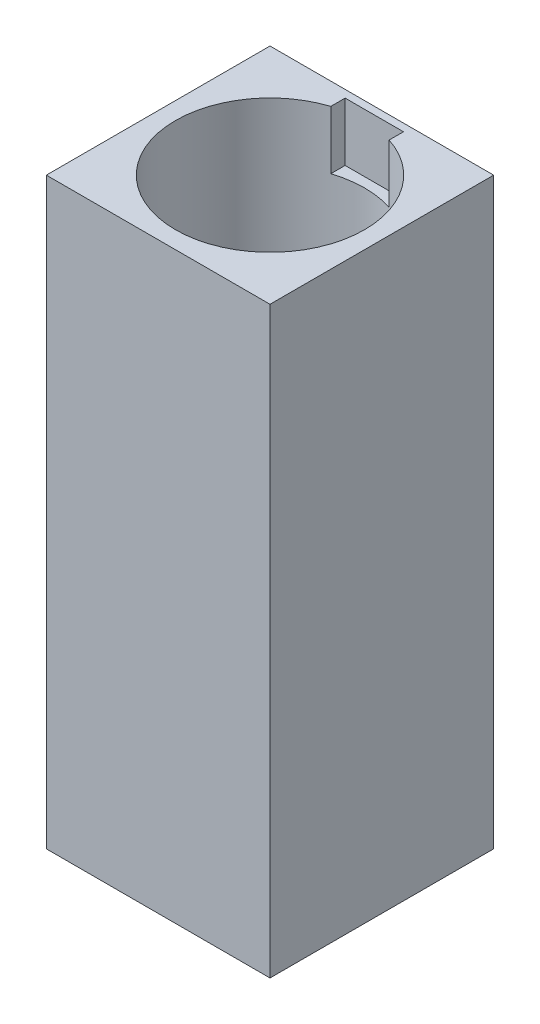
from build123d import *

# Parameters (mm, degrees)
SKETCH1_W           = 23
SKETCH1_H           = 23
BOSS_EXTRUDE1_DEPTH = 60
SKETCH2_R           = 9.725
CUT_EXTRUDE1_DEPTH  = 39
SKETCH3_R           = 6.75
CUT_EXTRUDE2_DEPTH  = 51.783855702
SKETCH5_W           = 6
SKETCH5_H           = 2.398717271
CUT_EXTRUDE3_DEPTH  = 6


with BuildPart() as part:
    # Sketch1 → Boss-Extrude1 (new body)
    with BuildSketch(Plane(origin=(0, 0, 0), x_dir=(-1, 0, 0), z_dir=(0, 1, 0))):
        with Locations((11.5, 11.5)):
            Rectangle(SKETCH1_W, SKETCH1_H)
    extrude(amount=BOSS_EXTRUDE1_DEPTH)

    # Sketch2 → Cut-Extrude1 (cut)
    with BuildSketch(Plane(origin=(0, 60, 0), x_dir=(-1, 0, 0), z_dir=(0, 1, 0))):
        with Locations(Location((11.5, 11.5, 0), (0, 0, 90))):
            Circle(SKETCH2_R)
    extrude(amount=-CUT_EXTRUDE1_DEPTH, mode=Mode.SUBTRACT)

    # Sketch3 → Cut-Extrude2 (cut, through all)
    with BuildSketch(Plane(origin=(0, 21, 0), x_dir=(-1, 0, 0), z_dir=(0, 1, 0))):
        with Locations(Location((11.5, 11.5, 0), (0, 0, 90))):
            Circle(SKETCH3_R)
    extrude(amount=-CUT_EXTRUDE2_DEPTH, mode=Mode.SUBTRACT)

    # Sketch5 → Cut-Extrude3 (cut)
    with BuildSketch(Plane(origin=(0, 60, 0), x_dir=(-1, 0, 0), z_dir=(0, 1, 0))):
        with Locations((11.5, 1.974358636)):
            Rectangle(SKETCH5_W, SKETCH5_H)
    extrude(amount=-CUT_EXTRUDE3_DEPTH, mode=Mode.SUBTRACT)


solid = part.part
